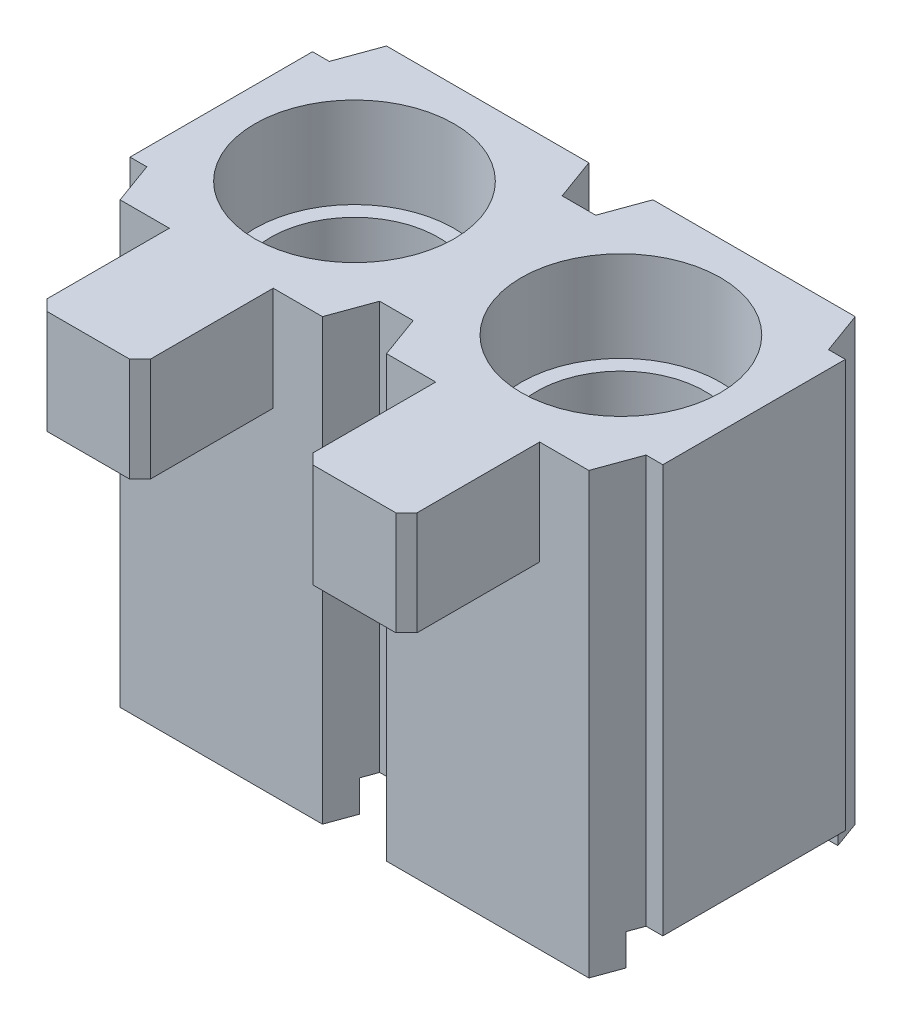
from build123d import *

# Parameters (mm, degrees)
EXTRUDE1_DEPTH      = 4.191
HOLE1_D             = 1.60274
HOLE1_CBORE_D       = 1.89992
HOLE1_CBORE_DEPTH   = 0.8636
EXTRUDE2_DEPTH      = 7.0104
LPATTERN1_COUNT     = 2
LPATTERN1_PITCH     = 2.54
LPATTERN2_COUNT     = 35
LPATTERN2_PITCH     = 2.54
SKETCH4_W           = 2.019808
SKETCH4_H           = 0.299974
EXTRUDE3_DEPTH      = 8.058504162
BOSS_EXTRUDE1_DEPTH = 0.9906
LPATTERN3_COUNT     = 2
LPATTERN3_PITCH     = 2.54


with BuildPart() as part:
    # Sketch1 → Extrude1 (new body)
    with BuildSketch(Plane(origin=(0, 0, 0), x_dir=(1, 0, 0), z_dir=(0, 1, 0))):
        Polygon((4.774373708, 0.40005), (4.614353708, 0.40005), (4.468747416, 0), (0, 0), (-0.145606292, 0.40005), (-0.305626292, 0.40005), (-0.305626292, 2.13995), (-0.145606292, 2.13995), (0, 2.54), (4.468747416, 2.54), (4.614353708, 2.13995), (4.774373708, 2.13995), align=None)
    extrude(amount=-EXTRUDE1_DEPTH)

    # Hole1 (through all)
    with Locations(Plane(origin=(0.964373708, 0, -1.27), x_dir=(0, 0, 1), z_dir=(0, 1, 0))):
        with Locations((0, 0)):
            hole1 = CounterBoreHole(HOLE1_D / 2, HOLE1_CBORE_D / 2, HOLE1_CBORE_DEPTH)

    # Sketch3 → Extrude2 (cut)
    with BuildSketch(Plane(origin=(0, 0, 0), x_dir=(1, 0, 0), z_dir=(0, 1, 0))):
        Polygon((1.928772816, 0), (2.5399746, 0), (2.394368308, 0.40005), (2.074379108, 0.40005), align=None)
        Polygon((2.074379108, 2.13995), (2.394368308, 2.13995), (2.5399746, 2.54), (1.928772816, 2.54), align=None)
    extrude2 = extrude(amount=-EXTRUDE2_DEPTH, mode=Mode.SUBTRACT)

    # LPattern1: Hole1 ×2
    with Locations(*[(i * LPATTERN1_PITCH, 0, 0) for i in range(1, LPATTERN1_COUNT)]):
        add(hole1, mode=Mode.SUBTRACT)

    # LPattern2: Extrude2 ×35
    with Locations(*[(i * LPATTERN2_PITCH, 0, 0) for i in range(1, LPATTERN2_COUNT)]):
        add(extrude2, mode=Mode.SUBTRACT)

    # Sketch4 → Extrude3 (cut, through all)
    with BuildSketch(Plane(origin=(4.774373708, 0, 0), x_dir=(0, 0, -1), z_dir=(1, 0, 0))):
        with Locations((1.27, -4.041013)):
            Rectangle(SKETCH4_W, SKETCH4_H)
    extrude(amount=-EXTRUDE3_DEPTH, mode=Mode.SUBTRACT)

    # Sketch5 → Boss-Extrude1 (add)
    with BuildSketch(Plane(origin=(0, 0, 0), x_dir=(-1, 0, 0), z_dir=(0, 1, 0))):
        Polygon((-0.469061008, 1.1684), (-0.570661008, 1.27), (-1.358061008, 1.27), (-1.459661008, 1.1684), (-1.459661008, 0), (-0.469061008, 0), align=None)
    boss_extrude1 = extrude(amount=-BOSS_EXTRUDE1_DEPTH)

    # LPattern3: Boss-Extrude1 ×2
    with Locations(*[(i * LPATTERN3_PITCH, 0, 0) for i in range(1, LPATTERN3_COUNT)]):
        add(boss_extrude1)


solid = part.part
